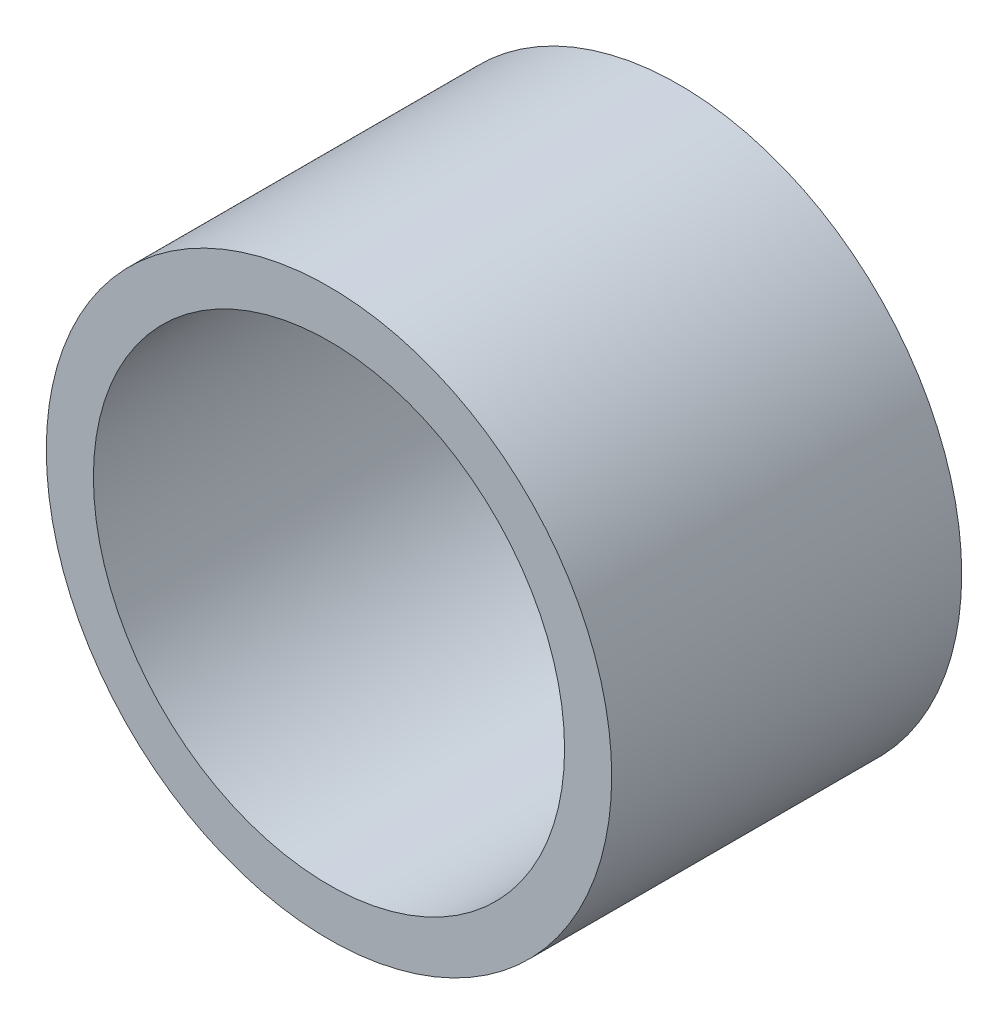
from build123d import *

# Parameters (mm, degrees)
SKETCH1_R           = 21
SKETCH1_R_2         = 17.5
BOSS_EXTRUDE1_DEPTH = 26


with BuildPart() as part:
    # Sketch1 → Boss-Extrude1 (new body)
    with BuildSketch(Plane.XY):
        with Locations(Location((0, 0, 0), (0, 0, 180))):
            Circle(SKETCH1_R)
        with Locations(Location((0, 0, 0), (0, 0, 180))):
            Circle(SKETCH1_R_2, mode=Mode.SUBTRACT)
    extrude(amount=BOSS_EXTRUDE1_DEPTH)


solid = part.part
